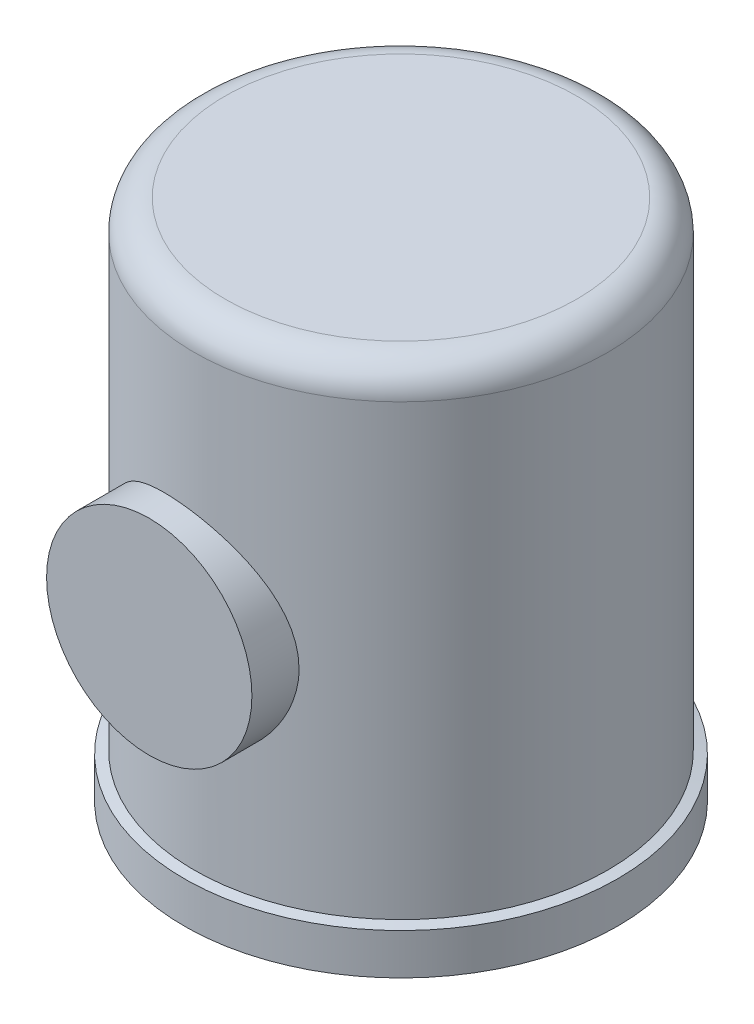
from build123d import *

# Parameters (mm, degrees)
SKETCH4_R           = 10
BOSS_EXTRUDE2_DEPTH = 6
CUT_EXTRUDE2_DEPTH  = 30


with BuildPart() as part:
    # Sketch1 → Revolve1 (revolve)
    with BuildSketch(Plane.XY):
        with BuildLine():
            Line((20.9, 0), (23.871591838, 0))
            Line((23.871591838, 0), (23.871591838, 4))
            Line((23.871591838, 4), (22.9, 4.236662843))
            Line((22.9, 4.236662843), (22.9, 47.908178136))
            ThreePointArc((22.9, 47.908178136), (22.021320344, 50.02949848), (19.9, 50.908178136))
            Line((19.9, 50.908178136), (2.764914955, 50.908178136))
            Line((2.764914955, 50.908178136), (2.764914955, 48.908178136))
            Line((2.764914955, 48.908178136), (18.9, 48.908178136))
            ThreePointArc((18.9, 48.908178136), (20.314213562, 48.322391698), (20.9, 46.908178136))
            Line((20.9, 46.908178136), (20.9, 13.908178136))
            Line((20.9, 13.908178136), (2.764914955, 13.908178136))
            Line((2.764914955, 13.908178136), (2.764914955, 11.908178136))
            Line((2.764914955, 11.908178136), (20.9, 11.908178136))
            Line((20.9, 11.908178136), (20.9, 0))
        make_face()
    revolve(axis=Axis((2.764914955, 4.729999793, 0), (0, 1, 0)))

    # Sketch4 → Boss-Extrude2 (add)
    with BuildSketch(Plane.XY.offset(22.9)):
        with Locations((1.144629865, 24.5)):
            Circle(SKETCH4_R)
    extrude(amount=-BOSS_EXTRUDE2_DEPTH)

    # Sketch9 → Cut-Extrude2 (cut)
    with BuildSketch(Plane(origin=(0, 40, 0), x_dir=(1, 0, 0), z_dir=(0, 1, 0))):
        with BuildLine():
            Line((-20.5, 0), (20.5, 0))
            ThreePointArc((20.5, 0), (0, 20.5), (-20.5, 0))
        make_face()
    extrude(amount=-CUT_EXTRUDE2_DEPTH, mode=Mode.SUBTRACT)


solid = part.part
